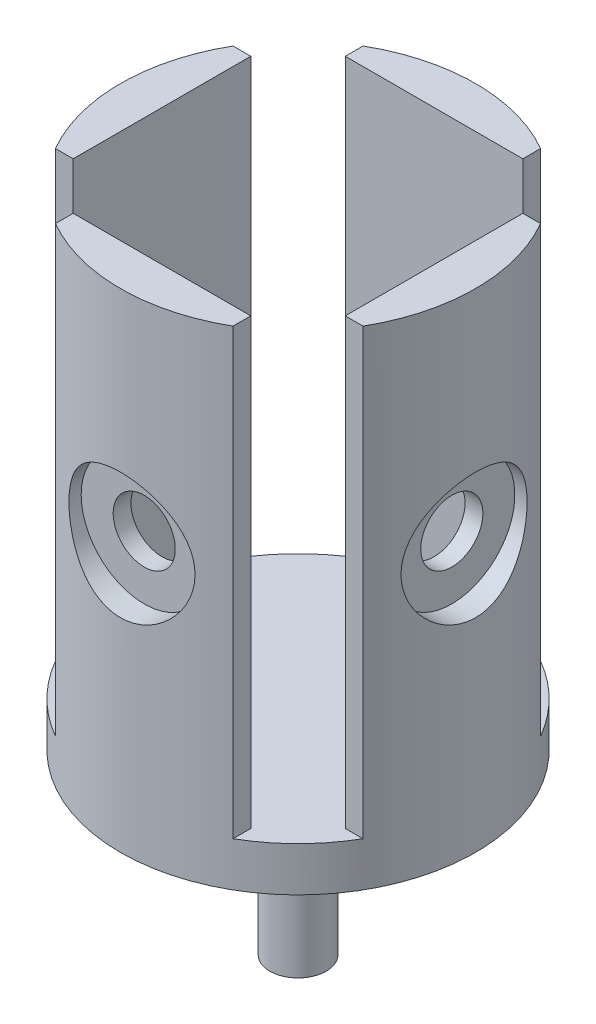
from build123d import *
from build123d.topology import SkipClean

# Parameters (mm, degrees)
SKETCH1_R           = 10
BOSS_EXTRUDE1_DEPTH = 2.5
BOSS_EXTRUDE2_DEPTH = 25
SKETCH5_R           = 1.587
BOSS_EXTRUDE3_DEPTH = 10
CIRPATTERN2_COUNT   = 4


with BuildPart() as part:
    # Sketch1 → Boss-Extrude1 (new body)
    with BuildSketch(Plane(origin=(0, 0, 0), x_dir=(1, 0, 0), z_dir=(0, 1, 0))):
        with Locations(Location((0, 0, 0), (0, 0, 270))):
            Circle(SKETCH1_R)
    extrude(amount=BOSS_EXTRUDE1_DEPTH)

    # Sketch3 → Boss-Extrude2 (add)
    with BuildSketch(Plane(origin=(0, 2.5, 0), x_dir=(1, 0, 0), z_dir=(0, 1, 0))):
        with BuildLine():
            Line((-7.660254038, 5), (-8.660254038, 5))
            ThreePointArc((-8.660254038, 5), (-10, 0), (-8.660254038, -5))
            Line((-8.660254038, -5), (-7.660254038, -5))
            Line((-7.660254038, -5), (-7.660254038, 5))
        make_face()
        with BuildLine():
            Line((-5, -7.660254038), (-5, -8.660254038))
            ThreePointArc((-5, -8.660254038), (0, -10), (5, -8.660254038))
            Line((5, -8.660254038), (5, -7.660254038))
            Line((5, -7.660254038), (-5, -7.660254038))
        make_face()
        with BuildLine():
            ThreePointArc((10, 0), (9.659258263, 2.588190451), (8.660254038, 5))
            Line((8.660254038, 5), (7.660254038, 5))
            Line((7.660254038, 5), (7.660254038, -5))
            Line((7.660254038, -5), (8.660254038, -5))
            ThreePointArc((8.660254038, -5), (9.659258263, -2.588190451), (10, 0))
        make_face()
        with BuildLine():
            ThreePointArc((5, 8.660254038), (0, 10), (-5, 8.660254038))
            Line((-5, 8.660254038), (-5, 7.660254038))
            Line((-5, 7.660254038), (5, 7.660254038))
            Line((5, 7.660254038), (5, 8.660254038))
        make_face()
    extrude(amount=BOSS_EXTRUDE2_DEPTH)

    # Sketch5 → Boss-Extrude3 (add)
    with BuildSketch(Plane(origin=(0, 0, 0), x_dir=(-1, 0, 0), z_dir=(0, -1, 0))):
        with Locations(Location((0, 0, 0), (0, 0, 90))):
            Circle(SKETCH5_R)
    extrude(amount=BOSS_EXTRUDE3_DEPTH)

    # Sketch7 → Cut-Revolve1 (revolve, cut)
    with BuildSketch(Plane(origin=(0, 15, 0), x_dir=(1, 0, 0), z_dir=(0, 1, 0))):
        Polygon((0, 7.660254038), (1.75, 7.660254038), (1.75, 8.660254038), (3.55, 8.660254038), (3.55, 10.3184344), (0, 10.3184344), align=None)
    cut_revolve1 = revolve(axis=Axis((0, 15, 0), (0, 0, -1)), mode=Mode.SUBTRACT)

    # CirPattern2: Cut-Revolve1 ×4 about axis
    with SkipClean():  # the faces are left unmerged after this step: merging them gives an invalid solid
        cirpattern2_axis = Axis((0, 0, 0), (0, 1, 0))
        for i in range(1, CIRPATTERN2_COUNT):
            add(cut_revolve1.rotate(cirpattern2_axis, i * 360 / CIRPATTERN2_COUNT), mode=Mode.SUBTRACT)


solid = part.part
